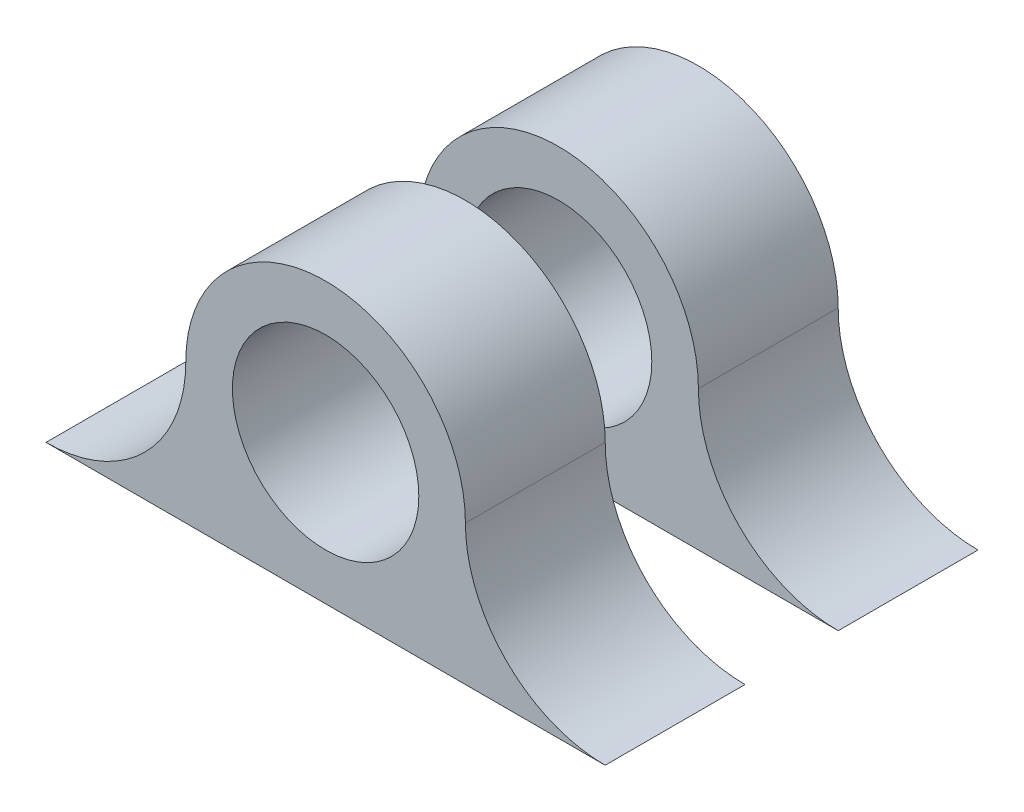
from build123d import *

# Parameters (mm, degrees)
EXTRUDE_4_DEPTH          = 1
EXTRUDE_4_DEPTH_BACK     = 1
SKETCH_2_R               = 0.5
CUT_EXTRUDE_2_DEPTH      = 0.25
CUT_EXTRUDE_2_DEPTH_BACK = 0.25
SKETCH_2_7_R             = 0.5


with BuildPart() as part:
    # 草圖2 → 填料-伸長4 (new, two sides: drawn at the far end of the back side and taken through both)
    with BuildSketch(Plane.XY.offset(-EXTRUDE_4_DEPTH_BACK)):
        with BuildLine():
            Line((3.5, 5), (6.5, 5))
            ThreePointArc((6.5, 5), (5.969669914, 5.219669914), (5.75, 5.75))
            ThreePointArc((5.75, 5.75), (5, 6.5), (4.25, 5.75))
            ThreePointArc((4.25, 5.75), (4.030330086, 5.219669914), (3.5, 5))
        make_face()
        with Locations((5, 5.75)):
            Circle(SKETCH_2_R, mode=Mode.SUBTRACT)
    extrude(amount=EXTRUDE_4_DEPTH + EXTRUDE_4_DEPTH_BACK)

    # 草圖2<7> → 除料-伸長2 (cut, two sides: drawn at the far end of the back side and taken through both)
    with BuildSketch(Plane.XY.offset(-CUT_EXTRUDE_2_DEPTH_BACK)):
        with BuildLine():
            Line((3.5, 5), (6.5, 5))
            ThreePointArc((6.5, 5), (5.969669914, 5.219669914), (5.75, 5.75))
            ThreePointArc((5.75, 5.75), (5, 6.5), (4.25, 5.75))
            ThreePointArc((4.25, 5.75), (4.030330086, 5.219669914), (3.5, 5))
        make_face()
        with Locations((5, 5.75)):
            Circle(SKETCH_2_7_R, mode=Mode.SUBTRACT)
    extrude(amount=CUT_EXTRUDE_2_DEPTH + CUT_EXTRUDE_2_DEPTH_BACK, mode=Mode.SUBTRACT)


with BuildPart() as cut_extrude_2_piece_1:
    # of the separate pieces the step leaves, piece 1, a body of its own (cut_extrude_2_pieces)
    add(part.part.solids().sort_by_distance((3.5, 5, 1))[0])


with BuildPart() as cut_extrude_2_piece_2:
    # of the separate pieces the step leaves, piece 2, a body of its own (cut_extrude_2_pieces)
    add(part.part.solids().sort_by_distance((3.5, 5, -0.25))[0])


solid = Compound([cut_extrude_2_piece_1.part, cut_extrude_2_piece_2.part])
